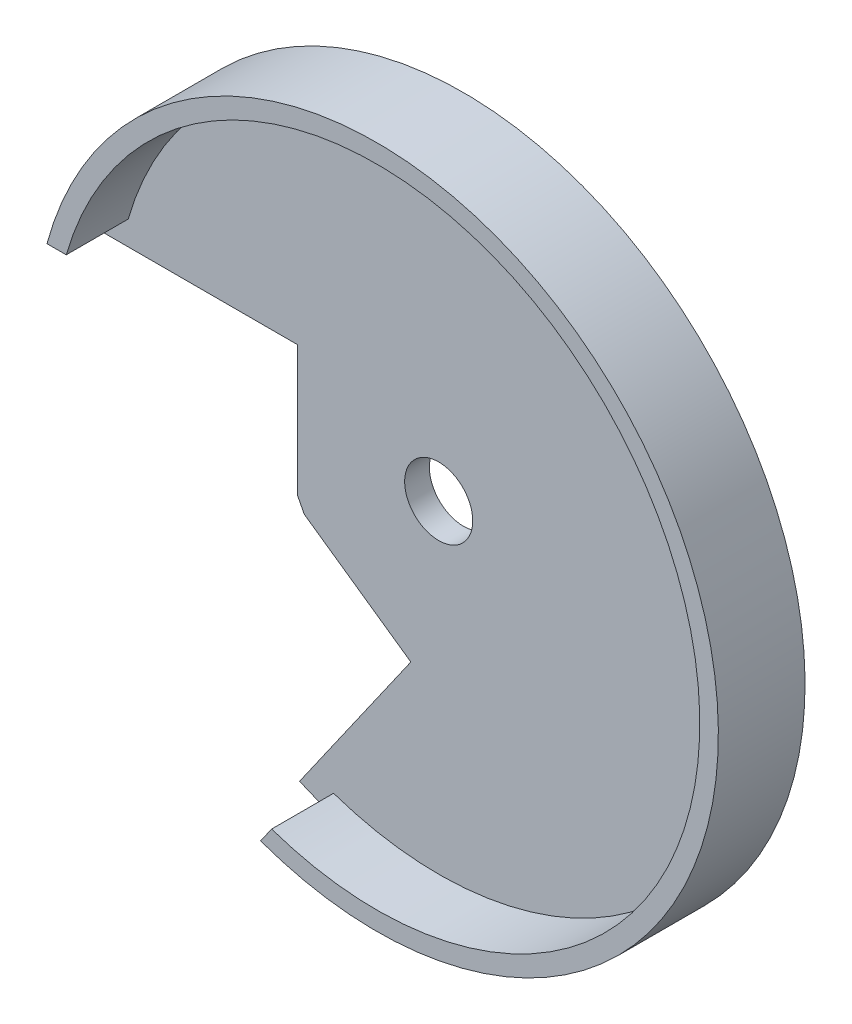
from build123d import *

# Parameters (mm, degrees)
BOSS_EXTRUDE1_DEPTH     = 3
BOSS_EXTRUDE1_2_DEPTH   = 3
BOSS_EXTRUDE2_START     = 1.2
SKETCH3_R               = 16.55
SKETCH3_R_2             = 1.65
BOSS_EXTRUDE2_DEPTH     = 1.2
CUT_EXTRUDE1_DEPTH      = 7.2
CUT_EXTRUDE1_DEPTH_BACK = 1.2
SKETCH5_R               = 15.65
CUT_EXTRUDE2_DEPTH      = 7.2


with BuildPart() as part:
    # Sketch2 → Boss-Extrude1 (new body)
    with BuildSketch(Plane.XY):
        with BuildLine():
            ThreePointArc((-3.097702158, 4.826453317), (-4.728295227, 7.32932211), (-5.843255553, 10.100612318))
            Line((-5.843255553, 10.100612318), (-7.089846629, 10.100612318))
            ThreePointArc((-7.089846629, 10.100612318), (-5.792708227, 6.775223774), (-3.812717425, 3.805305689))
            Line((-3.812717425, 3.805305689), (-3.097702158, 4.826453317))
        make_face()
    extrude(amount=BOSS_EXTRUDE1_DEPTH)



with BuildPart() as body_2:
    # Sketch2 → Boss-Extrude1 2 (new body)
    with BuildSketch(Plane.XY):
        with BuildLine():
            Line((-7.089846629, 18.733714328), (-5.843255553, 18.733714328))
            ThreePointArc((-5.843255553, 18.733714328), (11.067705083, 29.611518377), (24.237321062, 14.417163323))
            ThreePointArc((24.237321062, 14.417163323), (17.837317684, 1.946395084), (3.974121001, -0.125290568))
            Line((3.974121001, -0.125290568), (3.259105735, -1.146438196))
            ThreePointArc((3.259105735, -1.146438196), (18.394043324, 0.870033301), (25.437321062, 14.417163323))
            ThreePointArc((25.437321062, 14.417163323), (11.064518196, 30.823330232), (-7.089846629, 18.733714328))
        make_face()
    extrude(amount=BOSS_EXTRUDE1_2_DEPTH)


with BuildPart() as part_1:
    add(part.part)

    add(body_2.part)  # Boss-Extrude2 merges body 2
    # Sketch3 → Boss-Extrude2 (add)
    with BuildSketch(Plane(origin=(0, 0, 0), x_dir=(-1, 0, 0), z_dir=(0, 0, -1)).offset(BOSS_EXTRUDE2_START)):
        with Locations((-8.887321062, 14.417163323)):
            Circle(SKETCH3_R)
        with Locations((-8.887321062, 14.417163323)):
            Circle(SKETCH3_R_2, mode=Mode.SUBTRACT)
    extrude(amount=-BOSS_EXTRUDE2_DEPTH)

    # Sketch4 → Cut-Extrude1 (cut, two sides: drawn at the far end of the back side and taken through both)
    with BuildSketch(Plane.XY.offset(-CUT_EXTRUDE1_DEPTH_BACK)):
        with BuildLine():
            Line((2.037321062, 11.267163323), (2.037321062, 17.567163323))
            Line((2.037321062, 17.567163323), (-6.135994151, 17.567163323))
            ThreePointArc((-6.135994151, 17.567163323), (-6.462678938, 14.417163323), (-6.135994151, 11.267163323))
            Line((-6.135994151, 11.267163323), (2.037321062, 11.267163323))
        make_face()
        with BuildLine():
            ThreePointArc((-6.135994151, 11.267163323), (-6.462678938, 14.417163323), (-6.135994151, 17.567163323))
            Line((-6.135994151, 17.567163323), (-7.360140278, 17.567163323))
            ThreePointArc((-7.360140278, 17.567163323), (-7.662678938, 14.417163323), (-7.360140278, 11.267163323))
            Line((-7.360140278, 11.267163323), (-6.135994151, 11.267163323))
        make_face()
        with BuildLine():
            Line((2.148489026, -0.698743623), (2.850630399, 0.304018179))
            ThreePointArc((2.850630399, 0.304018179), (0.082922764, 1.843179443), (-2.31002748, 3.917549728))
            Line((-2.31002748, 3.917549728), (-3.012168853, 2.914787926))
            ThreePointArc((-3.012168853, 2.914787926), (-0.605368959, 0.86019699), (2.148489026, -0.698743623))
        make_face()
        with BuildLine():
            Line((7.538651413, 6.999206045), (2.377993534, 10.612737594))
            Line((2.377993534, 10.612737594), (-2.31002748, 3.917549728))
            ThreePointArc((-2.31002748, 3.917549728), (0.082922764, 1.843179443), (2.850630399, 0.304018179))
            Line((2.850630399, 0.304018179), (7.538651413, 6.999206045))
        make_face()
        with BuildLine():
            Line((2.377993534, 10.612737594), (2.037321062, 11.267163323))
            Line((2.037321062, 11.267163323), (-6.135994151, 11.267163323))
            ThreePointArc((-6.135994151, 11.267163323), (-4.728295227, 7.32932211), (-2.31002748, 3.917549728))
            Line((-2.31002748, 3.917549728), (2.377993534, 10.612737594))
        make_face()
        with BuildLine():
            ThreePointArc((-2.31002748, 3.917549728), (-4.728295227, 7.32932211), (-6.135994151, 11.267163323))
            Line((-6.135994151, 11.267163323), (-7.360140278, 11.267163323))
            ThreePointArc((-7.360140278, 11.267163323), (-5.792708227, 6.775223774), (-3.012168853, 2.914787926))
            Line((-3.012168853, 2.914787926), (-2.31002748, 3.917549728))
        make_face()
    extrude(amount=CUT_EXTRUDE1_DEPTH + CUT_EXTRUDE1_DEPTH_BACK, mode=Mode.SUBTRACT)

    # Sketch5 → Cut-Extrude2 (cut)
    with BuildSketch(Plane.XY):
        with Locations((8.887321062, 14.417163323)):
            Circle(SKETCH5_R)
    extrude(amount=CUT_EXTRUDE2_DEPTH, mode=Mode.SUBTRACT)


solid = part_1.part
